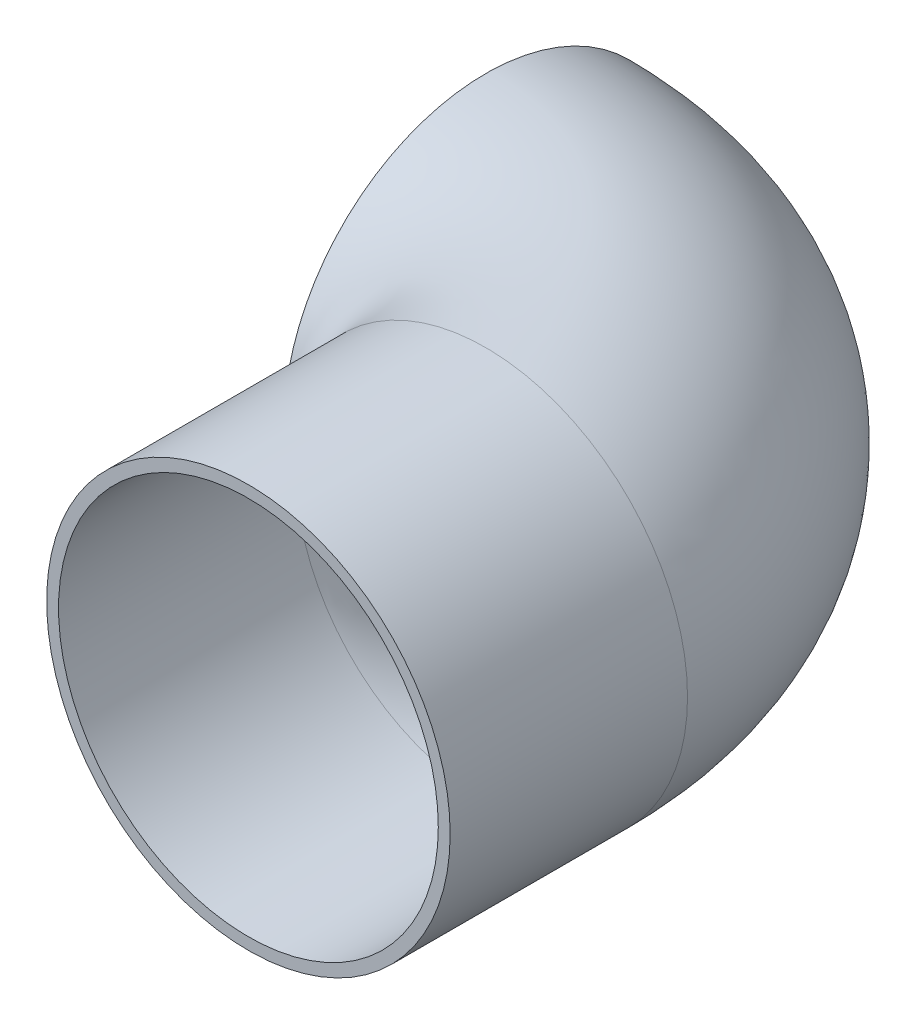
from build123d import *

# Parameters (mm, degrees)
SKETCH_2_R   = 8.5
SKETCH_2_R_2 = 8


with BuildPart() as part:
    # 扫描5: sweep along a path in 草图3
    with BuildLine(Plane(origin=(0, 0, 0), x_dir=(1, 0, 0), z_dir=(0, 1, 0))) as sweep_5_path:
        Line((0, 0), (0, 10))
        ThreePointArc((0, 10), (-2.928932188, 17.071067812), (-10, 20))
    # 草图2 → 扫描5 (sweep)
    with BuildSketch(Plane.XY):
        Circle(SKETCH_2_R)
        Circle(SKETCH_2_R_2, mode=Mode.SUBTRACT)
    sweep(path=sweep_5_path.line)


solid = part.part
